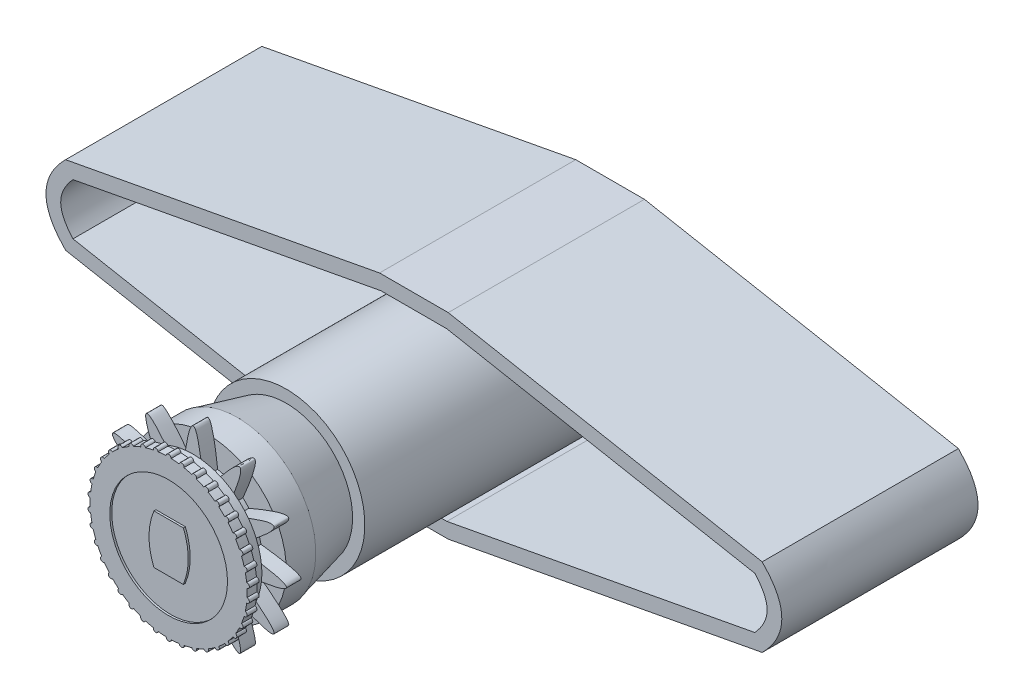
from build123d import *

# Parameters (mm, degrees)
SKETCH1_R            = 5.5
BOSS_EXTRUDE1_DEPTH  = 1.5
BOSS_EXTRUDE3_DEPTH  = 1.5
CIRPATTERN2_COUNT    = 12
SKETCH3_R            = 7
BOSS_EXTRUDE4_DEPTH  = 1.5
SKETCH4_R            = 8
BOSS_EXTRUDE5_DEPTH  = 1
SKETCH6_R            = 0.25
BOSS_EXTRUDE7_DEPTH  = 1
CIRPATTERN3_COUNT    = 38
SKETCH7_R            = 6
CUT_EXTRUDE1_DEPTH   = 0.2
BOSS_EXTRUDE9_DEPTH  = 0.2
BOSS_EXTRUDE10_START = 3
SKETCH10_R           = 8
BOSS_EXTRUDE10_DEPTH = 3
SKETCH11_R           = 6.75
BOSS_EXTRUDE11_DEPTH = 5
BOSS_EXTRUDE11_DRAFT = 13.7
BOSS_EXTRUDE12_START = 33
SKETCH12_R           = 8
BOSS_EXTRUDE12_DEPTH = 33
BOSS_EXTRUDE13_DEPTH = 20
SHELL1_T             = -1.5


with BuildPart() as part:
    # Sketch1 → Boss-Extrude1 (new body)
    with BuildSketch(Plane.XY):
        Circle(SKETCH1_R)
    extrude(amount=BOSS_EXTRUDE1_DEPTH)

    # Sketch2 → Boss-Extrude3 (add)
    with BuildSketch(Plane.XY.offset(1.5)):
        with BuildLine():
            Line((-1, 5.408326913), (1, 5.408326913))
            add(Edge.make_bspline(
                [(-1, 5.408326913), (0, 13.591673087), (1, 5.408326913)],
                knots=[0, 0, 0, 1, 1, 1], degree=2))
        make_face()
    boss_extrude3 = extrude(amount=-BOSS_EXTRUDE3_DEPTH)

    # CirPattern2: Boss-Extrude3 ×12 about axis
    cirpattern2_axis = Axis((0, 0, 1.5), (0, 0, -1))
    for i in range(1, CIRPATTERN2_COUNT):
        add(boss_extrude3.rotate(cirpattern2_axis, i * 360 / CIRPATTERN2_COUNT))

    # Sketch3 → Boss-Extrude4 (add)
    with BuildSketch(Plane.XY.offset(1.5)):
        with Locations(Location((0, 0, 0), (0, 0, 186.468500796))):
            Circle(SKETCH3_R)
    extrude(amount=BOSS_EXTRUDE4_DEPTH)

    # Sketch4 → Boss-Extrude5 (add)
    with BuildSketch(Plane.XY.offset(3)):
        Circle(SKETCH4_R)
    extrude(amount=BOSS_EXTRUDE5_DEPTH)

    # Sketch6 → Boss-Extrude7 (add)
    with BuildSketch(Plane.XY.offset(4)):
        with Locations((0, 8)):
            Circle(SKETCH6_R)
    boss_extrude7 = extrude(amount=-BOSS_EXTRUDE7_DEPTH)

    # CirPattern3: Boss-Extrude7 ×38 about axis
    cirpattern3_axis = Axis((0, 0, 0), (0, 0, 1))
    for i in range(1, CIRPATTERN3_COUNT):
        add(boss_extrude7.rotate(cirpattern3_axis, i * 360 / CIRPATTERN3_COUNT))

    # Sketch7 → Cut-Extrude1 (cut)
    with BuildSketch(Plane.XY.offset(4)):
        Circle(SKETCH7_R)
    extrude(amount=-CUT_EXTRUDE1_DEPTH, mode=Mode.SUBTRACT)

    # Sketch8 → Boss-Extrude9 (add)
    with BuildSketch(Plane.XY.offset(3.8)):
        with BuildLine():
            Line((-1.5, -2.5), (1.5, -2.5))
            add(Edge.make_bspline(
                [(1.5, 2.5), (2.5, 0), (1.5, -2.5)],
                knots=[0, 0, 0, 1, 1, 1], degree=2))
            Line((1.5, 2.5), (-1.5, 2.5))
            add(Edge.make_bspline(
                [(-1.5, 2.5), (-2.5, 0), (-1.5, -2.5)],
                knots=[0, 0, 0, 1, 1, 1], degree=2))
        make_face()
    extrude(amount=BOSS_EXTRUDE9_DEPTH)

    # Sketch10 → Boss-Extrude10 (add)
    with BuildSketch(Plane(origin=(0, 0, 0), x_dir=(-1, 0, 0), z_dir=(0, 0, -1)).offset(BOSS_EXTRUDE10_START)):
        with Locations(Location((0, 0, 0), (0, 0, 175.625814657))):
            Circle(SKETCH10_R)
    extrude(amount=-BOSS_EXTRUDE10_DEPTH)


with BuildPart() as boss_extrude11_tool:
    # Sketch11 → Boss-Extrude11 (with draft: the straight prism first)
    with BuildSketch(Plane(origin=(0, 0, -8), x_dir=(-1, 0, 0), z_dir=(0, 0, -1))):
        Circle(SKETCH11_R)
    extrude(amount=-BOSS_EXTRUDE11_DEPTH)
    # Boss-Extrude11: the draft: its side faces are tilted about the plane it starts from
    boss_extrude11_sides = [boss_extrude11_tool.faces().sort_by_distance(p)[0] for p in [
        (6.75, 0, -5.5),
    ]]
    draft(boss_extrude11_sides, Plane(origin=(0, 0, -8), x_dir=(-1, 0, 0), z_dir=(0, 0, -1)), BOSS_EXTRUDE11_DRAFT)


with BuildPart() as part_1:
    add(part.part)

    # Boss-Extrude11: add boss_extrude11_tool
    add(boss_extrude11_tool.part)

    # Sketch12 → Boss-Extrude12 (add)
    with BuildSketch(Plane(origin=(0, 0, -8), x_dir=(-1, 0, 0), z_dir=(0, 0, -1)).offset(BOSS_EXTRUDE12_START)):
        with Locations(Location((0, 0, 0), (0, 0, 175.625814657))):
            Circle(SKETCH12_R)
    extrude(amount=-BOSS_EXTRUDE12_DEPTH)


with BuildPart() as body_2:
    # Sketch13 → Boss-Extrude13 (new body)
    with BuildSketch(Plane(origin=(0, 0, -41), x_dir=(-1, 0, 0), z_dir=(0, 0, -1))):
        with BuildLine():
            Line((-35.498712818, 3.999687238), (-3.498712818, 9.999687238))
            Line((-3.498712818, 9.999687238), (3.501287182, 9.999687238))
            Line((3.501287182, 9.999687238), (35.501287182, 3.999687238))
            add(Edge.make_bspline(
                [(35.501287182, 3.999687238), (39.501287182, -0.000312762), (35.501287182, -4.000312762)],
                knots=[0, 0, 0, 1, 1, 1], degree=2))
            Line((35.501287182, -4.000312762), (3.501287182, -10.000312762))
            Line((3.501287182, -10.000312762), (-3.498712818, -10.000312762))
            Line((-3.498712818, -10.000312762), (-35.498712818, -4.000312762))
            add(Edge.make_bspline(
                [(-35.498712818, 3.999687238), (-39.498712818, -0.000312762), (-35.498712818, -4.000312762)],
                knots=[0, 0, 0, 1, 1, 1], degree=2))
        make_face()
    extrude(amount=-BOSS_EXTRUDE13_DEPTH)

    # Shell1
    shell1_openings = [body_2.faces().sort_by_distance(p)[0] for p in [
        (-0.001287182, -0.000312762, -21),
    ]]
    offset(amount=SHELL1_T, openings=shell1_openings, kind=Kind.INTERSECTION)


solid = Compound([part_1.part, body_2.part])
